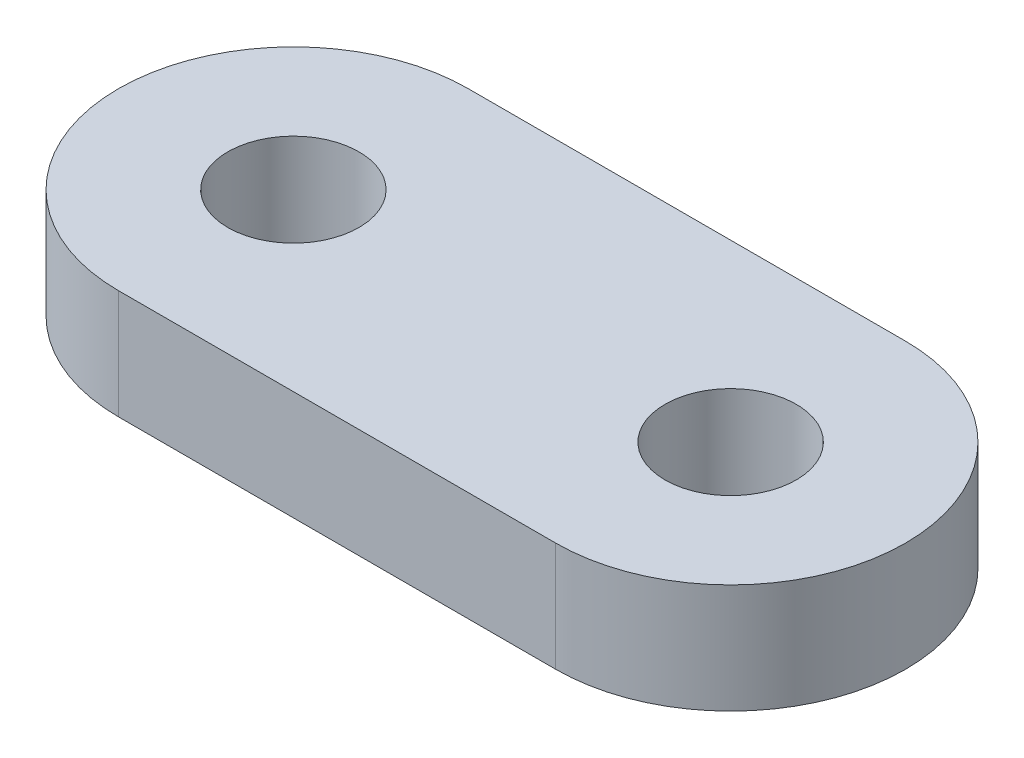
from build123d import *

# Parameters (mm, degrees)
SKETCH_1_R      = 3
EXTRUDE_1_DEPTH = 5


with BuildPart() as part:
    # 草圖1 → 填料-伸長1 (new body)
    with BuildSketch(Plane(origin=(0, 0, 0), x_dir=(1, 0, 0), z_dir=(0, 1, 0))):
        with BuildLine():
            Line((-10, 8), (10, 8))
            ThreePointArc((10, 8), (18, 0), (10, -8))
            Line((10, -8), (-10, -8))
            ThreePointArc((-10, -8), (-18, 0), (-10, 8))
        make_face()
        with Locations(Location((-10, 0, 0), (0, 0, 270))):
            Circle(SKETCH_1_R, mode=Mode.SUBTRACT)
        with Locations(Location((10, 0, 0), (0, 0, 270))):
            Circle(SKETCH_1_R, mode=Mode.SUBTRACT)
    extrude(amount=EXTRUDE_1_DEPTH)


solid = part.part
